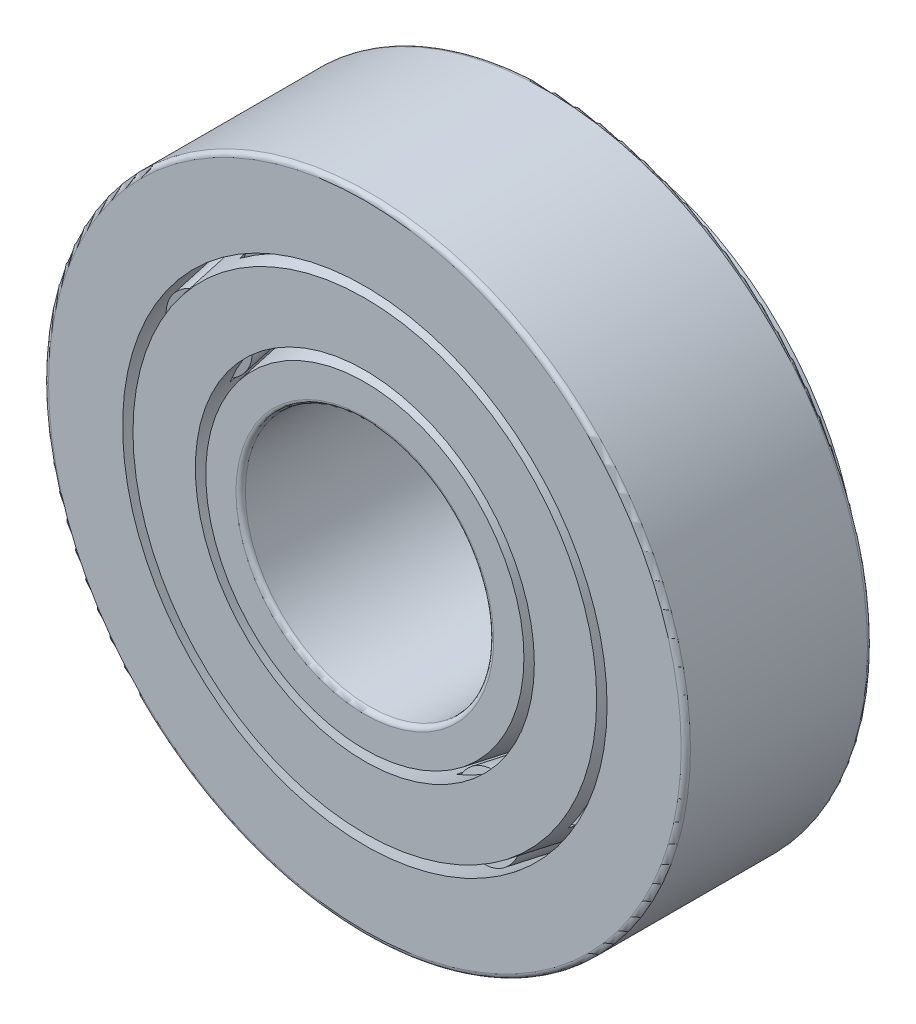
from build123d import *

# Parameters (mm, degrees)
CIRPATTERN1_COUNT = 12
CIRPATTERN2_COUNT = 12
CIRPATTERN2_ANGLE = 330
FILLET1_R         = 0.3571875
FILLET2_R         = 0.3571875


with BuildPart() as part:
    # Sketch1 → Revolve1 (revolve)
    with BuildSketch(Plane(origin=(0, 0, 0), x_dir=(0, 0, -1), z_dir=(1, 0, 0)), mode=Mode.PRIVATE) as revolve1_sk:
        Polygon((-9.525, 24.6126), (4.7625, 24.6126), (4.7625, 21.096831737), (-9.525, 18.57756), align=None)
    revolve(revolve1_sk.sketch.rotate(Axis((0, 0, 9.525), (0, 0, -1)), 90), axis=Axis((0, 0, 9.525), (0, 0, -1)))

    # Fillet1
    fillet1_edges = [part.edges().sort_by_distance(p)[0] for p in [
        (-24.6126, 0, -4.7625),
        (-24.6126, 0, 9.525),
    ]]
    fillet(fillet1_edges, radius=FILLET1_R)


with BuildPart() as body_2:
    # Sketch5 → Revolve4 (revolve)
    with BuildSketch(Plane(origin=(0, 0, 0), x_dir=(0, 0, -1), z_dir=(1, 0, 0)), mode=Mode.PRIVATE) as revolve4_sk:
        Polygon((9.525, 15.56004), (-9.525, 12.201011018), (-9.525, 9.525), (9.525, 9.525), align=None)
    revolve(revolve4_sk.sketch.rotate(Axis((0, 0, 9.525), (0, 0, -1)), 90), axis=Axis((0, 0, 9.525), (0, 0, -1)))

    # Fillet2
    fillet2_edges = [body_2.edges().sort_by_distance(p)[0] for p in [
        (-9.525, 0, 9.525),
        (-9.525, 0, -9.525),
    ]]
    fillet(fillet2_edges, radius=FILLET2_R)


with BuildPart() as body_3:
    # Sketch2 → Revolve2 (revolve)
    with BuildSketch(Plane(origin=(0, 0, 0), x_dir=(0, 0, -1), z_dir=(1, 0, 0)), mode=Mode.PRIVATE) as revolve2_sk:
        Polygon((-9.525, 17.780491377), (-9.525, 12.99807964), (4.7625, 15.517351377), (8.372693238, 16.153925851), (7.554852664, 20.792130228), (4.7625, 20.299763114), align=None)
    revolve(revolve2_sk.sketch.rotate(Axis((0, 0, 9.525), (0, 0, -1)), 90), axis=Axis((0, 0, 9.525), (0, 0, -1)))

    # Sketch3 → Cut-Revolve1 (revolve, cut)
    with BuildSketch(Plane(origin=(0, 0, 0), x_dir=(0, 0, -1), z_dir=(1, 0, 0))):
        Polygon((-7.889318852, 15.677700227), (-8.434545902, 18.769836479), (4.217272951, 21.000693497), (4.7625, 17.908557246), align=None)
    cut_revolve1 = revolve(axis=Axis((0, 15.389285509, 9.525), (0, 0.17364817766692786, -0.9848077530122086)), mode=Mode.SUBTRACT)

    # CirPattern1: Cut-Revolve1 ×12 about axis
    cirpattern1_axis = Axis((0, 0, 0), (0, 0, 1))
    for i in range(1, CIRPATTERN1_COUNT):
        add(cut_revolve1.rotate(cirpattern1_axis, i * 360 / CIRPATTERN1_COUNT), mode=Mode.SUBTRACT)


with BuildPart() as body_4:
    # Sketch4 → Revolve3 (revolve)
    with BuildSketch(Plane(origin=(0, 0, 0), x_dir=(0, 0, -1), z_dir=(1, 0, 0)), mode=Mode.PRIVATE) as revolve3_sk:
        Polygon((-8.390439264, 18.51969531), (4.261379588, 20.750552328), (4.7625, 17.908557246), (-7.889318852, 15.677700227), align=None)
    revolve(revolve3_sk.sketch.rotate(Axis((0, 15.389285509, 9.525), (0, 0.17364817766692786, -0.9848077530122086)), 180), axis=Axis((0, 15.389285509, 9.525), (0, 0.17364817766692786, -0.9848077530122086)))


with BuildPart() as cirpattern2_1:
    # CirPattern2: pattern copy
    add(body_4.part.rotate(Axis((0, 0, -9.525), (0, 0, 1)), 1 * CIRPATTERN2_ANGLE / (CIRPATTERN2_COUNT - 1)))


with BuildPart() as cirpattern2_2:
    # CirPattern2: pattern copy
    add(body_4.part.rotate(Axis((0, 0, -9.525), (0, 0, 1)), 2 * CIRPATTERN2_ANGLE / (CIRPATTERN2_COUNT - 1)))


with BuildPart() as cirpattern2_3:
    # CirPattern2: pattern copy
    add(body_4.part.rotate(Axis((0, 0, -9.525), (0, 0, 1)), 3 * CIRPATTERN2_ANGLE / (CIRPATTERN2_COUNT - 1)))


with BuildPart() as cirpattern2_4:
    # CirPattern2: pattern copy
    add(body_4.part.rotate(Axis((0, 0, -9.525), (0, 0, 1)), 4 * CIRPATTERN2_ANGLE / (CIRPATTERN2_COUNT - 1)))


with BuildPart() as cirpattern2_5:
    # CirPattern2: pattern copy
    add(body_4.part.rotate(Axis((0, 0, -9.525), (0, 0, 1)), 5 * CIRPATTERN2_ANGLE / (CIRPATTERN2_COUNT - 1)))


with BuildPart() as cirpattern2_6:
    # CirPattern2: pattern copy
    add(body_4.part.rotate(Axis((0, 0, -9.525), (0, 0, 1)), 6 * CIRPATTERN2_ANGLE / (CIRPATTERN2_COUNT - 1)))


with BuildPart() as cirpattern2_7:
    # CirPattern2: pattern copy
    add(body_4.part.rotate(Axis((0, 0, -9.525), (0, 0, 1)), 7 * CIRPATTERN2_ANGLE / (CIRPATTERN2_COUNT - 1)))


with BuildPart() as cirpattern2_8:
    # CirPattern2: pattern copy
    add(body_4.part.rotate(Axis((0, 0, -9.525), (0, 0, 1)), 8 * CIRPATTERN2_ANGLE / (CIRPATTERN2_COUNT - 1)))


with BuildPart() as cirpattern2_9:
    # CirPattern2: pattern copy
    add(body_4.part.rotate(Axis((0, 0, -9.525), (0, 0, 1)), 9 * CIRPATTERN2_ANGLE / (CIRPATTERN2_COUNT - 1)))


with BuildPart() as cirpattern2_10:
    # CirPattern2: pattern copy
    add(body_4.part.rotate(Axis((0, 0, -9.525), (0, 0, 1)), 10 * CIRPATTERN2_ANGLE / (CIRPATTERN2_COUNT - 1)))


with BuildPart() as cirpattern2_11:
    # CirPattern2: pattern copy
    add(body_4.part.rotate(Axis((0, 0, -9.525), (0, 0, 1)), 11 * CIRPATTERN2_ANGLE / (CIRPATTERN2_COUNT - 1)))


solid = Compound([part.part, body_2.part, body_3.part, body_4.part, cirpattern2_1.part, cirpattern2_2.part, cirpattern2_3.part, cirpattern2_4.part, cirpattern2_5.part, cirpattern2_6.part, cirpattern2_7.part, cirpattern2_8.part, cirpattern2_9.part, cirpattern2_10.part, cirpattern2_11.part])
